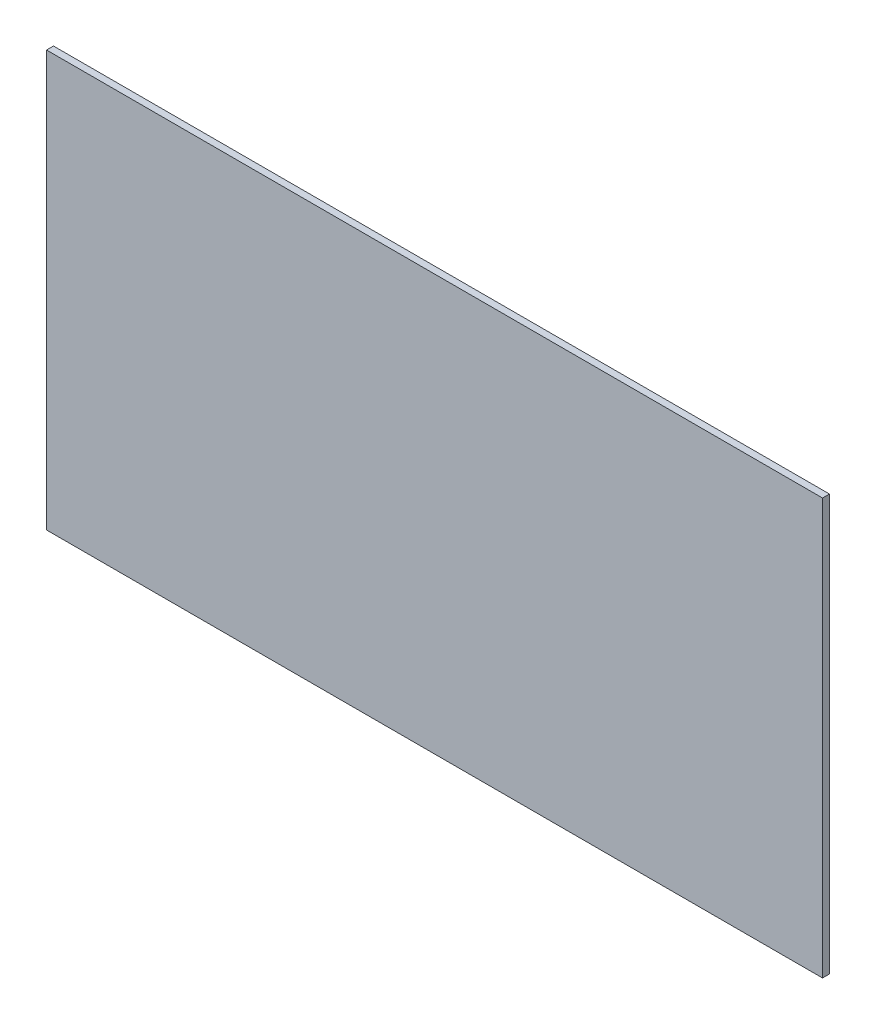
from build123d import *

# Parameters (mm, degrees)
SCHIZZO1_W                   = 280
SCHIZZO1_H                   = 150
ESTRUSIONE_ESTRUSIONE1_DEPTH = 2.5


with BuildPart() as part:
    # Schizzo1 → Estrusione-Estrusione1 (new body)
    with BuildSketch(Plane.XY):
        with Locations((140, 75)):
            Rectangle(SCHIZZO1_W, SCHIZZO1_H)
    extrude(amount=ESTRUSIONE_ESTRUSIONE1_DEPTH)


solid = part.part
